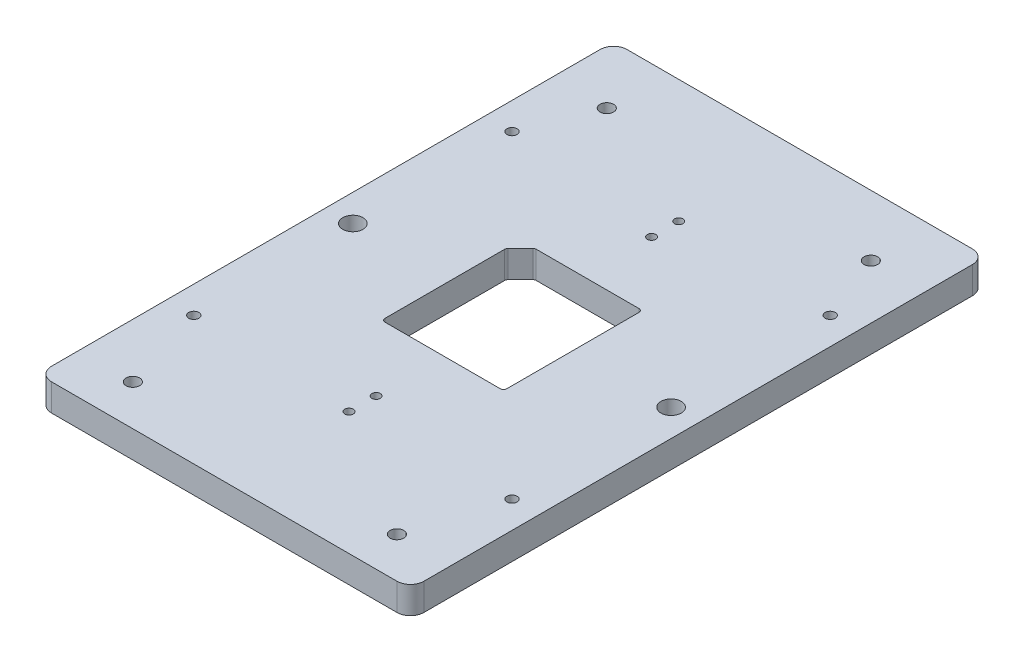
from build123d import *

# Parameters (mm, degrees)
SALIENTE_EXTRUIR1_DEPTH = 8
CROQUIS2_R              = 2
CROQUIS2_R_2            = 1.5
CROQUIS2_R_3            = 3
CORTAR_EXTRUIR1_DEPTH   = 18
CROQUIS3_W              = 36
CROQUIS3_H              = 41
CORTAR_EXTRUIR2_DEPTH   = 8
CROQUIS4_W              = 50
CROQUIS4_H              = 90
CORTAR_EXTRUIR3_DEPTH   = 8
CROQUIS5_W              = 59.93105858
CROQUIS5_H              = 100.56613239
SALIENTE_EXTRUIR2_DEPTH = 8
CROQUIS7_W              = 94.273148937
CROQUIS7_H              = 8.636825756
SALIENTE_EXTRUIR3_DEPTH = 8
CROQUIS8_R              = 2
CORTAR_EXTRUIR4_DEPTH   = 102.557865279
CROQUIS9_R              = 1.25
CORTAR_EXTRUIR5_DEPTH   = 8


with BuildPart() as part:
    # Croquis1 → Saliente-Extruir1 (new body)
    with BuildSketch(Plane(origin=(0, 0, 0), x_dir=(1, 0, 0), z_dir=(0, 1, 0))):
        with BuildLine():
            Line((-51, 85), (51, 85))
            ThreePointArc((51, 85), (53.828427125, 83.828427125), (55, 81))
            Line((55, 81), (55, -81))
            ThreePointArc((55, -81), (53.828427125, -83.828427125), (51, -85))
            Line((51, -85), (-51, -85))
            ThreePointArc((-51, -85), (-53.828427125, -83.828427125), (-55, -81))
            Line((-55, -81), (-55, 81))
            ThreePointArc((-55, 81), (-53.828427125, 83.828427125), (-51, 85))
        make_face()
    extrude(amount=SALIENTE_EXTRUIR1_DEPTH)

    # Croquis2 → Cortar-Extruir1 (cut)
    with BuildSketch(Plane(origin=(0, 8, 0), x_dir=(1, 0, 0), z_dir=(0, 1, 0))):
        with Locations(Location((-39, 73, 0), (0, 0, 270))):
            Circle(CROQUIS2_R)
        with Locations(Location((-47, 47, 0), (0, 0, 270))):
            Circle(CROQUIS2_R_2)
        with Locations(Location((47, 47, 0), (0, 0, 270))):
            Circle(CROQUIS2_R_2)
        with Locations(Location((39, 73, 0), (0, 0, 270))):
            Circle(CROQUIS2_R)
        with Locations(Location((39, -73, 0), (0, 0, 270))):
            Circle(CROQUIS2_R)
        with Locations(Location((47, -47, 0), (0, 0, 270))):
            Circle(CROQUIS2_R_2)
        with Locations(Location((-47, -47, 0), (0, 0, 270))):
            Circle(CROQUIS2_R_2)
        with Locations(Location((-39, -73, 0), (0, 0, 270))):
            Circle(CROQUIS2_R)
        with Locations(Location((-47, 0, 0), (0, 0, 270))):
            Circle(CROQUIS2_R_3)
        with Locations(Location((47, 0, 0), (0, 0, 270))):
            Circle(CROQUIS2_R_3)
    extrude(amount=-CORTAR_EXTRUIR1_DEPTH, mode=Mode.SUBTRACT)

    # Croquis3 → Cortar-Extruir2 (cut)
    with BuildSketch(Plane(origin=(0, 8, 0), x_dir=(1, 0, 0), z_dir=(0, 1, 0))):
        Rectangle(CROQUIS3_W, CROQUIS3_H)
    extrude(amount=-CORTAR_EXTRUIR2_DEPTH, mode=Mode.SUBTRACT)

    # Croquis4 → Cortar-Extruir3 (cut)
    with BuildSketch(Plane.XZ):
        Rectangle(CROQUIS4_W, CROQUIS4_H)
    extrude(amount=-CORTAR_EXTRUIR3_DEPTH, mode=Mode.SUBTRACT)

    # Croquis5 → Saliente-Extruir2 (add)
    with BuildSketch(Plane.XZ):
        with Locations((0.580457048, 0.547604551)):
            Rectangle(CROQUIS5_W, CROQUIS5_H)
        with BuildLine():
            Line((-13.343145751, -20.5), (17, -20.5))
            ThreePointArc((17, -20.5), (17.707106781, -20.207106781), (18, -19.5))
            Line((18, -19.5), (18, 19.5))
            ThreePointArc((18, 19.5), (17.707106781, 20.207106781), (17, 20.5))
            Line((17, 20.5), (-17, 20.5))
            ThreePointArc((-17, 20.5), (-17.707106781, 20.207106781), (-18, 19.5))
            Line((-18, 19.5), (-18, -15.843145751))
            ThreePointArc((-18, -15.843145751), (-17.923879533, -16.225829183), (-17.707106781, -16.550252532))
            Line((-17.707106781, -16.550252532), (-14.050252532, -20.207106781))
            ThreePointArc((-14.050252532, -20.207106781), (-13.725829183, -20.423879533), (-13.343145751, -20.5))
        make_face(mode=Mode.SUBTRACT)
    extrude(amount=-SALIENTE_EXTRUIR2_DEPTH)

    # Croquis7 → Saliente-Extruir3 (add)
    with BuildSketch(Plane(origin=(0, 8, 0), x_dir=(1, 0, 0), z_dir=(0, 1, 0))):
        with Locations((1.18677705, 71.991192559)):
            Rectangle(CROQUIS7_W, CROQUIS7_H)
    extrude(amount=-SALIENTE_EXTRUIR3_DEPTH)

    # Croquis8 → Cortar-Extruir4 (cut, through all)
    with BuildSketch(Plane(origin=(0, 8, 0), x_dir=(1, 0, 0), z_dir=(0, 1, 0))):
        with Locations(Location((-39, 67, 0), (0, 0, 270))):
            Circle(CROQUIS8_R)
        with Locations(Location((39, 67, 0), (0, 0, 270))):
            Circle(CROQUIS8_R)
    extrude(amount=-CORTAR_EXTRUIR4_DEPTH, mode=Mode.SUBTRACT)

    # Croquis9 → Cortar-Extruir5 (cut)
    with BuildSketch(Plane.XZ):
        with Locations(Location((0.547678372, 40.686961559, 0), (0, 0, 270))):
            Circle(CROQUIS9_R)
        with Locations(Location((0.547678372, 48.686961559, 0), (0, 0, 270))):
            Circle(CROQUIS9_R)
        with Locations(Location((0.547678372, -48.686961559, 0), (0, 0, 90))):
            Circle(CROQUIS9_R)
        with Locations(Location((0.547678372, -40.686961559, 0), (0, 0, 90))):
            Circle(CROQUIS9_R)
    extrude(amount=-CORTAR_EXTRUIR5_DEPTH, mode=Mode.SUBTRACT)


solid = part.part
